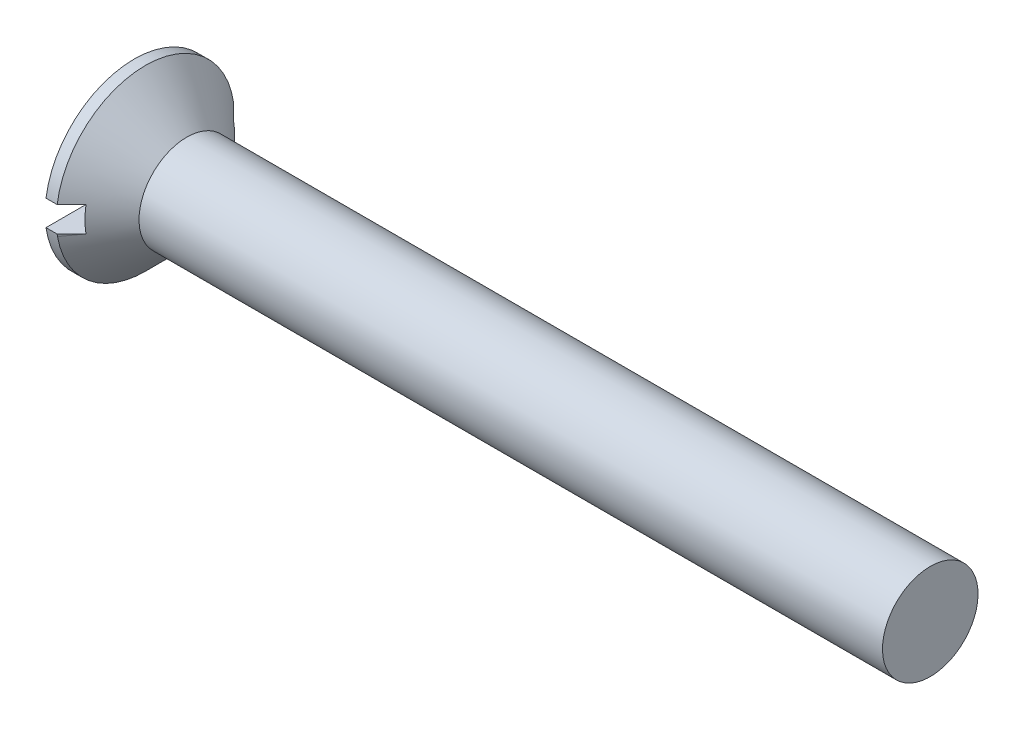
from build123d import *

# Parameters (mm, degrees)
SKETCH2_W          = 5.6
SKETCH2_H          = 0.8
CUT_EXTRUDE1_DEPTH = 0.8


with BuildPart() as part:
    # Sketch1 → Revolve1 (revolve)
    with BuildSketch(Plane.XY):
        Polygon((0, 0), (0, 2.8), (0.35, 2.8), (1.65, 1.5), (25, 1.5), (25, 0), align=None)
    revolve(axis=Axis((25, 0, 0), (-1, 0, 0)))

    # Sketch2 → Cut-Extrude1 (cut)
    with BuildSketch(Plane.ZY):
        Rectangle(SKETCH2_W, SKETCH2_H)
    extrude(amount=-CUT_EXTRUDE1_DEPTH, mode=Mode.SUBTRACT)


solid = part.part
